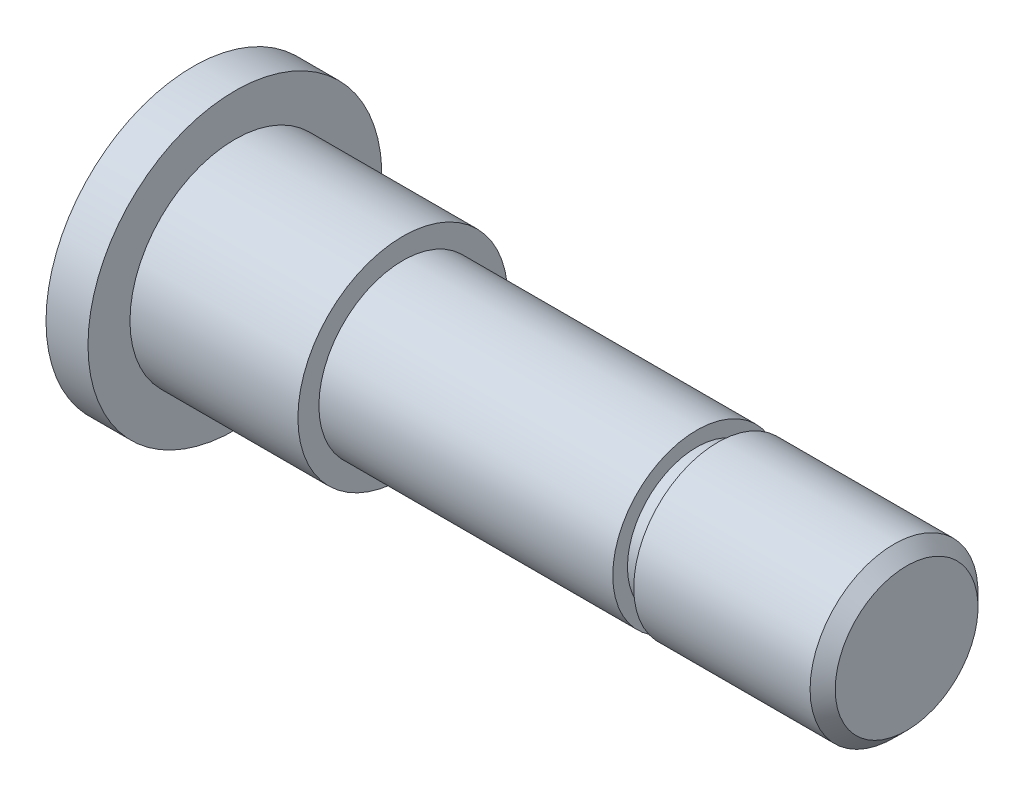
from build123d import *

# Parameters (mm, degrees)
CHANFREIN1_SIZE = 0.6


with BuildPart() as part:
    # Esquisse1 → Base-Révolution (revolve)
    with BuildSketch(Plane.XY, mode=Mode.PRIVATE) as base_r_volution_sk:
        Polygon((0, 0), (0, 7), (2, 7), (2, 5), (10, 5), (10, 4), (24, 4), (24, 3.3), (25, 3.3), (25, 4), (34, 4), (34, 0), align=None)
    revolve(base_r_volution_sk.sketch.rotate(Axis((-12.574722565, 0, 0), (1, 0, 0)), 90), axis=Axis((-12.574722565, 0, 0), (1, 0, 0)))

    # Chanfrein1
    chanfrein1_edges = [part.edges().sort_by_distance(p)[0] for p in [
        (34, 0, -4),
    ]]
    chamfer(chanfrein1_edges, length=CHANFREIN1_SIZE)


solid = part.part
